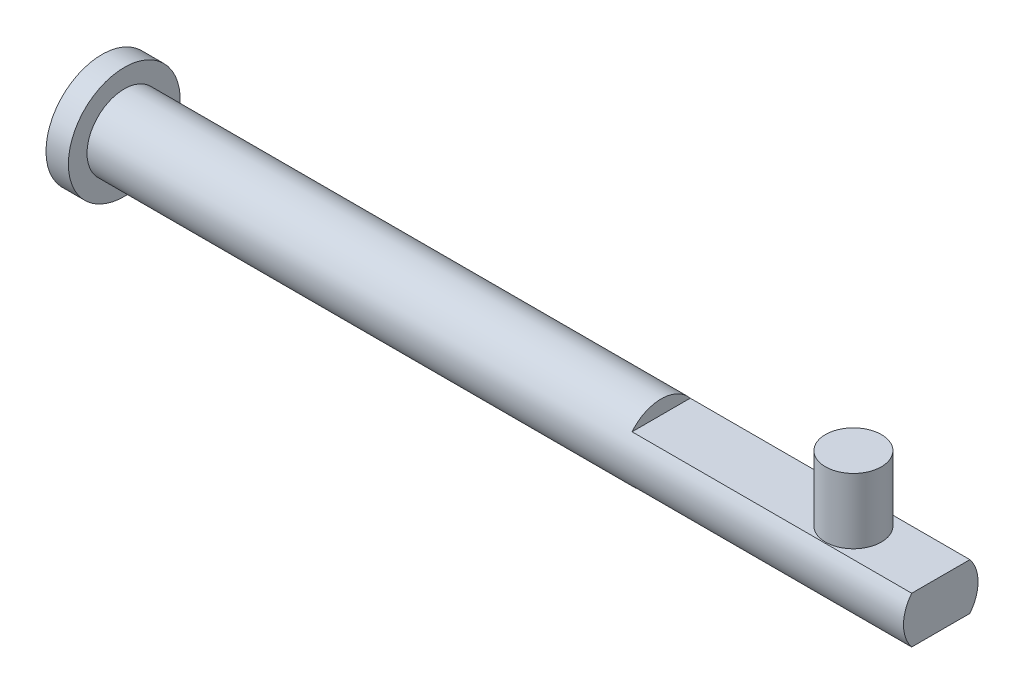
from build123d import *

# Parameters (mm, degrees)
SKETCH4_OUTSIDE_W   = 62.634
SKETCH4_OUTSIDE_H   = 62.634
SKETCH4_OUTSIDE_W_2 = 33.924910587
SKETCH4_OUTSIDE_H_2 = 10
CUT_EXTRUDE1_DEPTH  = 60
SKETCH9_R           = 6
BOSS_EXTRUDE1_DEPTH = 14


with BuildPart() as part:
    # Sketch1 → Revolve1 (revolve)
    with BuildSketch(Plane(origin=(0, 0, 0), x_dir=(1, 0, 0), z_dir=(0, 1, 0))):
        Polygon((57.735849057, -1.8), (57.735849057, 6.2), (-117.46468802, 6.2), (-117.46468802, 10.2), (-122.264150943, 10.2), (-122.264150943, -1.8), align=None)
    revolve(axis=Axis((-122.264150943, 0, 1.8), (1, 0, 0)))

    # Sketch4 outside → Cut-Extrude1 (cut)
    with BuildSketch(Plane(origin=(57.735849057, 0, 0), x_dir=(0, 0, -1), z_dir=(1, 0, 0))):
        with Locations((-1.8, 0)):
            Rectangle(SKETCH4_OUTSIDE_W, SKETCH4_OUTSIDE_H)
        with Locations((-4.763294948, 0)):
            Rectangle(SKETCH4_OUTSIDE_W_2, SKETCH4_OUTSIDE_H_2, mode=Mode.SUBTRACT)
    extrude(amount=-CUT_EXTRUDE1_DEPTH, mode=Mode.SUBTRACT)

    # Sketch9 → Boss-Extrude1 (add)
    with BuildSketch(Plane(origin=(0, 5, 0), x_dir=(1, 0, 0), z_dir=(0, 1, 0))):
        with Locations((38.985849057, -1.8)):
            Circle(SKETCH9_R)
    extrude(amount=BOSS_EXTRUDE1_DEPTH)


solid = part.part
